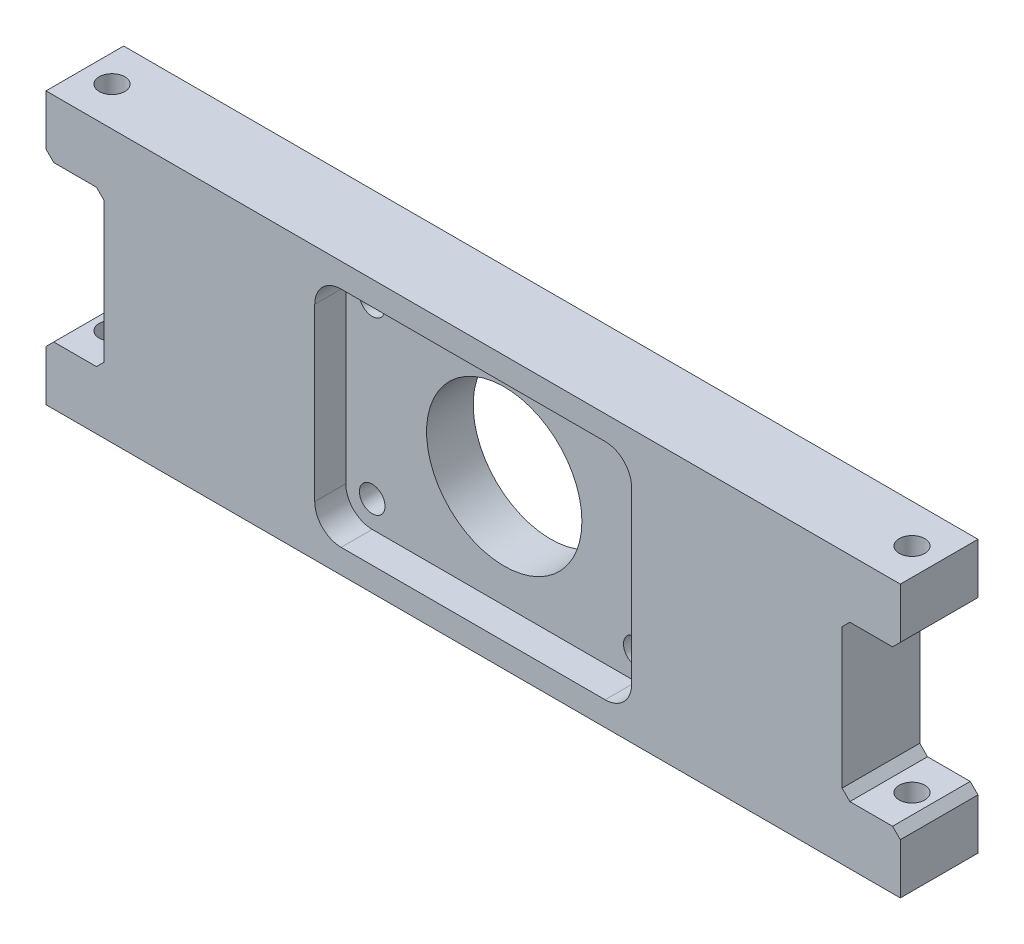
from build123d import *

# Parameters (mm, degrees)
SKETCH_1_W          = 110
SKETCH_1_H          = 35
SKETCH_1_R          = 1.65
EXTRUDE_1_DEPTH     = 10
SKETCH_3_W          = 40
SKETCH_3_H          = 28
CUT_EXTRUDE_1_DEPTH = 4
FILLET_1_R          = 3
SKETCH_4_R          = 1.65
CUT_EXTRUDE_2_DEPTH = 66.954529791
CUT_EXTRUDE_3_DEPTH = 4
SKETCH_7_W          = 15
SKETCH_7_H          = 20
CUT_EXTRUDE_5_DEPTH = 59.576872569
CHAMFER_1_SIZE      = 1
SKETCH_8_R          = 10
CUT_EXTRUDE_6_DEPTH = 10


with BuildPart() as part:
    # 草图1 → 凸台-拉伸1 (new body)
    with BuildSketch(Plane.XY):
        Rectangle(SKETCH_1_W, SKETCH_1_H)
        with Locations((-17, 11)):
            Circle(SKETCH_1_R, mode=Mode.SUBTRACT)
        with Locations((17, 11)):
            Circle(SKETCH_1_R, mode=Mode.SUBTRACT)
        with Locations((17, -11)):
            Circle(SKETCH_1_R, mode=Mode.SUBTRACT)
        with Locations((-17, -11)):
            Circle(SKETCH_1_R, mode=Mode.SUBTRACT)
    extrude(amount=EXTRUDE_1_DEPTH)

    # 草图3 → 切除-拉伸1 (cut)
    with BuildSketch(Plane.XY.offset(10)):
        Rectangle(SKETCH_3_W, SKETCH_3_H)
    extrude(amount=-CUT_EXTRUDE_1_DEPTH, mode=Mode.SUBTRACT)

    # 圆角1
    fillet_1_edges = [part.edges().sort_by_distance(p)[0] for p in [
        (-20, -14, 8),
        (-20, 14, 8),
        (20, 14, 8),
        (20, -14, 8),
    ]]
    fillet(fillet_1_edges, radius=FILLET_1_R)

    # 草图4 → 切除-拉伸2 (cut, through all)
    with BuildSketch(Plane.XZ.offset(17.5)):
        with Locations((-51.5, 5)):
            Circle(SKETCH_4_R)
        with Locations(Location((51.5, 5, 0), (0, 0, 180))):
            Circle(SKETCH_4_R)
    extrude(amount=-CUT_EXTRUDE_2_DEPTH, mode=Mode.SUBTRACT)

    # 草图5 → 切除-拉伸3 (cut)
    with BuildSketch(Plane.XY.offset(6)):
        with BuildLine():
            Line((-17, -14.4), (17, -14.4))
            ThreePointArc((17, -14.4), (19.404163056, -13.404163056), (20.4, -11))
            Line((20.4, -11), (20.4, 11))
            ThreePointArc((20.4, 11), (19.404163056, 13.404163056), (17, 14.4))
            Line((17, 14.4), (-17, 14.4))
            ThreePointArc((-17, 14.4), (-19.404163056, 13.404163056), (-20.4, 11))
            Line((-20.4, 11), (-20.4, -11))
            ThreePointArc((-20.4, -11), (-19.404163056, -13.404163056), (-17, -14.4))
        make_face()
    extrude(amount=CUT_EXTRUDE_3_DEPTH, mode=Mode.SUBTRACT)

    # 草图7 → 切除-拉伸5 (cut, through all)
    with BuildSketch(Plane(origin=(0, 0, 0), x_dir=(-1, 0, 0), z_dir=(0, 0, -1))):
        with Locations((-55, 0)):
            Rectangle(SKETCH_7_W, SKETCH_7_H)
        with Locations((55, 0)):
            Rectangle(SKETCH_7_W, SKETCH_7_H)
    extrude(amount=-CUT_EXTRUDE_5_DEPTH, mode=Mode.SUBTRACT)

    # 倒角1
    chamfer_1_edges = [part.edges().sort_by_distance(p)[0] for p in [
        (55, -10, 5),
        (47.5, -10, 5),
        (55, 10, 5),
        (47.5, 10, 5),
        (-55, 10, 5),
        (-47.5, 10, 5),
        (-55, -10, 5),
        (-47.5, -10, 5),
    ]]
    chamfer(chamfer_1_edges, length=CHAMFER_1_SIZE)

    # 草图8 → 切除-拉伸6 (cut)
    with BuildSketch(Plane.XY.offset(6)):
        Circle(SKETCH_8_R)
    extrude(amount=-CUT_EXTRUDE_6_DEPTH, mode=Mode.SUBTRACT)


solid = part.part
